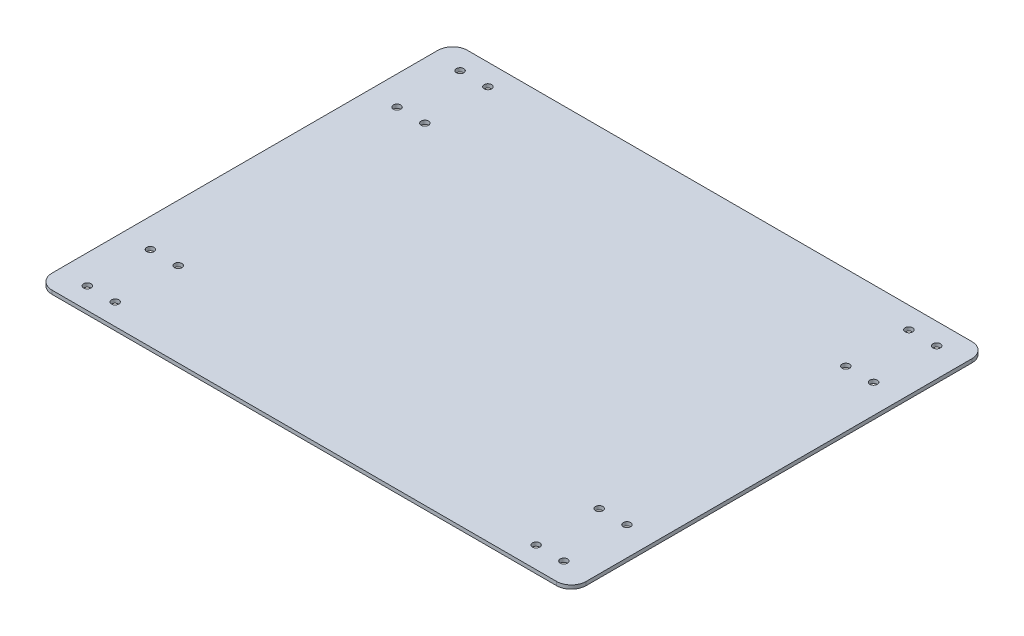
from build123d import *

# Parameters (mm, degrees)
SKETCH1_W               = 457.2
SKETCH1_H               = 355.6
BOSS_EXTRUDE1_DEPTH     = 3.175
FILLET1_R               = 12.7
SKETCH3_R               = 3.175
CUT_EXTRUDE1_DEPTH      = 290.621961572
MIRROR2_COPY_1_SKETCH_R = 3.175
MIRROR2_COPY_1_DEPTH    = 290.621961572


with BuildPart() as part:
    # Sketch1 → Boss-Extrude1 (new body)
    with BuildSketch(Plane(origin=(0, 0, 0), x_dir=(1, 0, 0), z_dir=(0, 1, 0))):
        Rectangle(SKETCH1_W, SKETCH1_H)
    extrude(amount=BOSS_EXTRUDE1_DEPTH)

    # Fillet1
    fillet1_edges = [part.edges().sort_by_distance(p)[0] for p in [
        (-228.6, 1.5875, 177.8),
        (228.6, 1.5875, 177.8),
        (228.6, 1.5875, -177.8),
        (-228.6, 1.5875, -177.8),
    ]]
    fillet(fillet1_edges, radius=FILLET1_R)

    # Sketch3 → Cut-Extrude1 (cut, through all)
    with BuildSketch(Plane.XZ):
        with Locations(Location((180.18125, -159.54375, 0), (0, 0, 270))):
            Circle(SKETCH3_R)
        with Locations(Location((180.18125, -105.56875, 0), (0, 0, 270))):
            Circle(SKETCH3_R)
        with Locations(Location((203.99375, -159.54375, 0), (0, 0, 270))):
            Circle(SKETCH3_R)
        with Locations(Location((203.99375, -105.56875, 0), (0, 0, 270))):
            Circle(SKETCH3_R)
    cut_extrude1 = extrude(amount=-CUT_EXTRUDE1_DEPTH, mode=Mode.SUBTRACT)

    # Mirror1: Cut-Extrude1 across plane
    add(cut_extrude1.mirror(Plane.XY), mode=Mode.SUBTRACT)

    # Mirror2: Cut-Extrude1 across plane
    add(cut_extrude1.mirror(Plane(origin=(0, 0, 0), x_dir=(0, 0, 1), z_dir=(1, 0, 0))), mode=Mode.SUBTRACT)

    # Mirror2 copy 1 sketch → Mirror2 copy 1 (cut, through all)
    with BuildSketch(Plane(origin=(0, 0, 0), x_dir=(-1, 0, 0), z_dir=(0, -1, 0))):
        with Locations(Location((180.18125, -159.54375, 0), (0, 0, 270))):
            Circle(MIRROR2_COPY_1_SKETCH_R)
        with Locations(Location((180.18125, -105.56875, 0), (0, 0, 270))):
            Circle(MIRROR2_COPY_1_SKETCH_R)
        with Locations(Location((203.99375, -159.54375, 0), (0, 0, 270))):
            Circle(MIRROR2_COPY_1_SKETCH_R)
        with Locations(Location((203.99375, -105.56875, 0), (0, 0, 270))):
            Circle(MIRROR2_COPY_1_SKETCH_R)
    extrude(amount=-MIRROR2_COPY_1_DEPTH, mode=Mode.SUBTRACT)


solid = part.part
